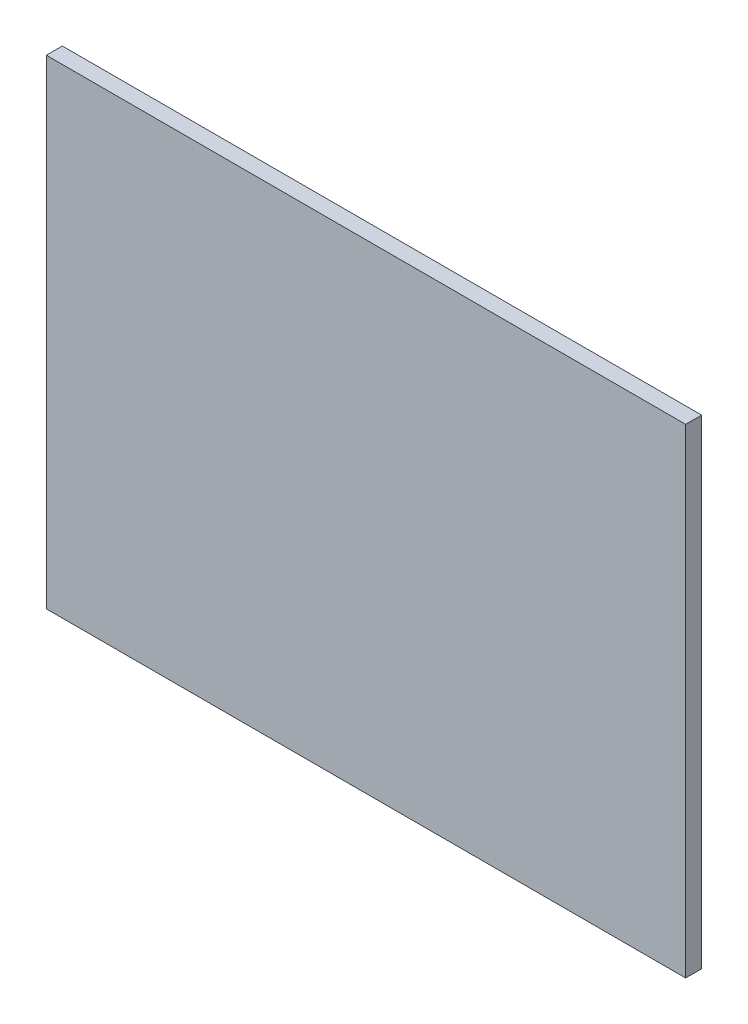
from build123d import *

# Parameters (mm, degrees)
SKETCH1_W           = 80
SKETCH1_H           = 60
BOSS_EXTRUDE1_DEPTH = 2


with BuildPart() as part:
    # Sketch1 → Boss-Extrude1 (new body)
    with BuildSketch(Plane.XY):
        with Locations((-25.869565217, 18.586956522)):
            Rectangle(SKETCH1_W, SKETCH1_H)
    extrude(amount=BOSS_EXTRUDE1_DEPTH)


solid = part.part
